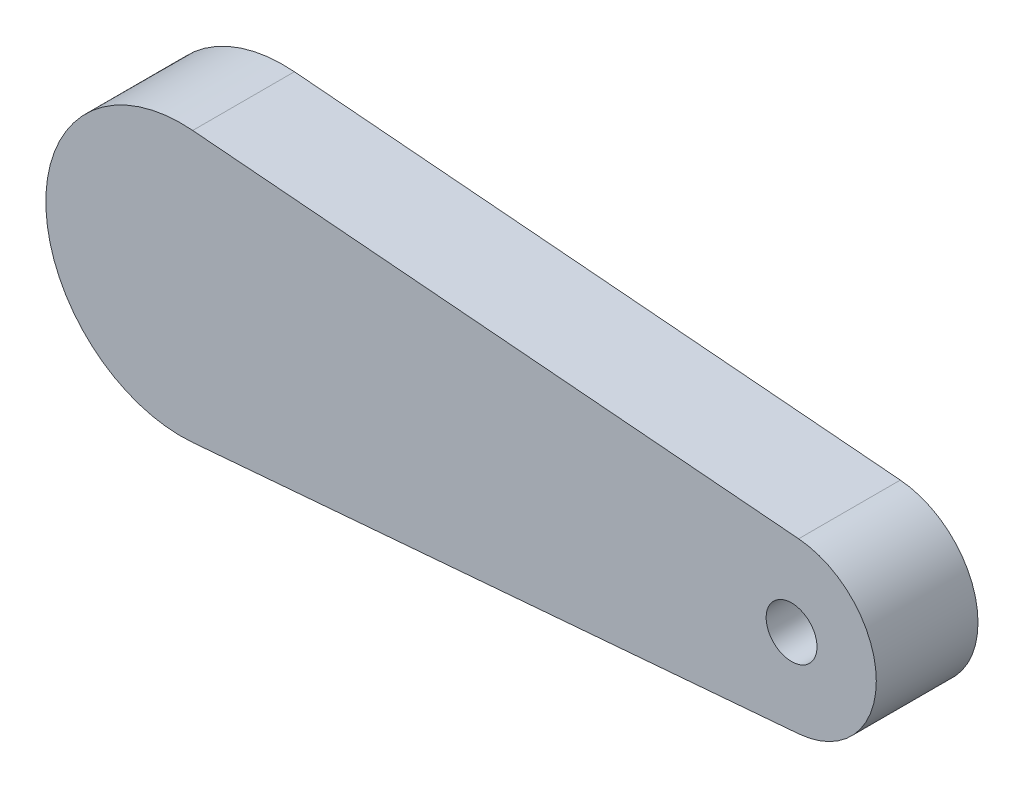
from build123d import *

# Parameters (mm, degrees)
BOSS_EXTRUDE1_DEPTH = 30
SKETCH2_R           = 5
CUT_EXTRUDE1_DEPTH  = 10
SKETCH3_R           = 7.5
CUT_EXTRUDE2_DEPTH  = 69


with BuildPart() as part:
    # Sketch1 → Boss-Extrude1 (new body)
    with BuildSketch(Plane.XY):
        with BuildLine():
            Line((3.333333333, 39.860869144), (182.083333333, 24.913043215))
            ThreePointArc((182.083333333, 24.913043215), (205, 0), (182.083333333, -24.913043215))
            Line((182.083333333, -24.913043215), (3.333333333, -39.860869144))
            ThreePointArc((3.333333333, -39.860869144), (-40, 0), (3.333333333, 39.860869144))
        make_face()
    extrude(amount=BOSS_EXTRUDE1_DEPTH)

    # Sketch2 → Cut-Extrude1 (cut)
    with BuildSketch(Plane(origin=(0, 0, 0), x_dir=(-1, 0, 0), z_dir=(0, 0, -1))):
        Circle(SKETCH2_R)
    extrude(amount=-CUT_EXTRUDE1_DEPTH, mode=Mode.SUBTRACT)

    # Sketch3 → Cut-Extrude2 (cut)
    with BuildSketch(Plane.XY.offset(30)):
        with Locations((180, 0)):
            Circle(SKETCH3_R)
    extrude(amount=-CUT_EXTRUDE2_DEPTH, mode=Mode.SUBTRACT)


solid = part.part
